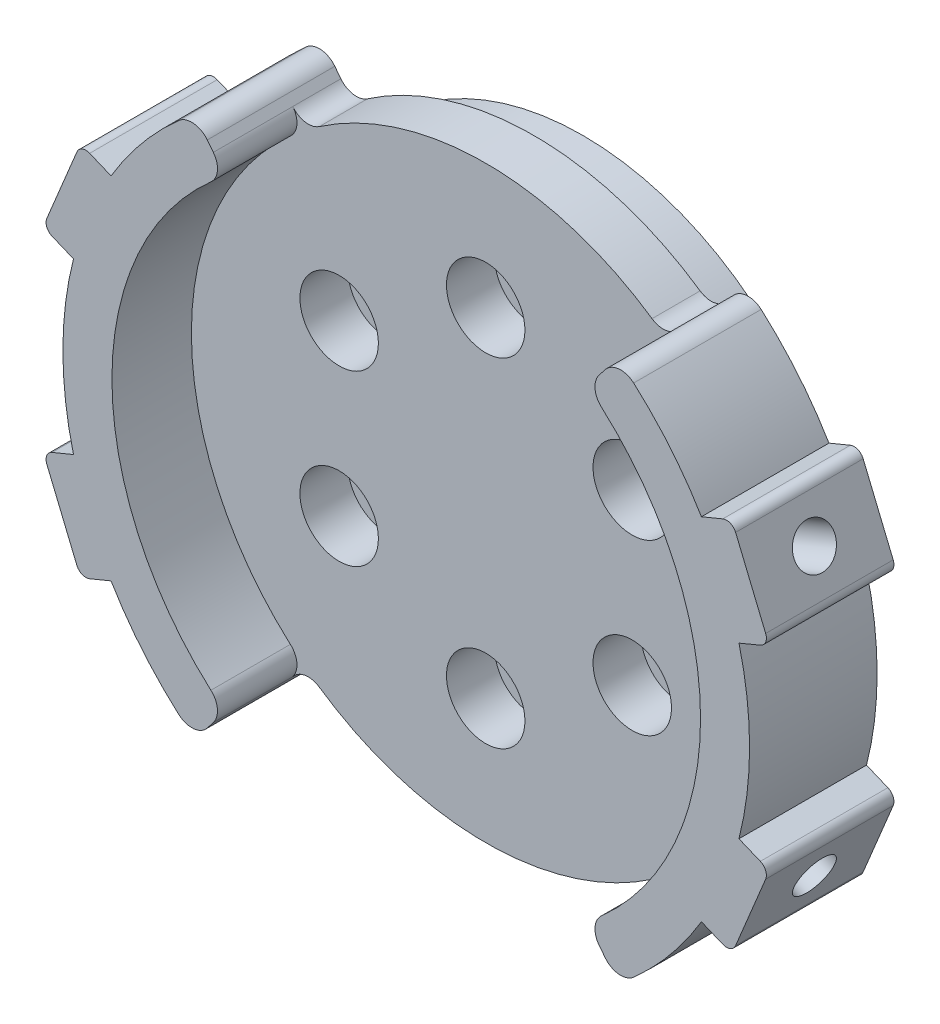
from build123d import *
from build123d.topology import SkipClean

# Parameters (mm, degrees)
SKETCH_1_R           = 30
SKETCH_1_R_2         = 2.1
EXTRUDE_1_DEPTH      = 5
EXTRUDE_2_DEPTH      = 8
EXTRUDE_2_DEPTH_BACK = 5
EXTRUDE_3_DEPTH      = 13
CUT_EXTRUDE_2_DEPTH  = 7.5
CUT_EXTRUDE_3_DEPTH  = 7.5
CUT_EXTRUDE_START    = -7.5
CUT_EXTRUDE_4_DEPTH  = 7.5
CUT_EXTRUDE_5_DEPTH  = 7.5
FILLET_1_R           = 2
FILLET_2_R           = 2
EXTRUDE_START        = 5
SKETCH_8_R           = 27.5
SKETCH_8_R_2         = 2.1
EXTRUDE_4_DEPTH      = 5
CUT_EXTRUDE_START_2  = -5
SKETCH_9_R           = 4
SKETCH_9_R_2         = 2.1
CUT_EXTRUDE_6_DEPTH  = 5
FILLET_3_R           = 1
CUT_EXTRUDE_START_3  = -0.1
CUT_EXTRUDE_7_DEPTH  = 0.1


with BuildPart() as part:
    # 草图1 → 凸台-拉伸1 (new body)
    with BuildSketch(Plane.XY):
        Circle(SKETCH_1_R)
        with Locations((0, 17.25)):
            Circle(SKETCH_1_R_2, mode=Mode.SUBTRACT)
        with Locations((14.938938215, 8.625)):
            Circle(SKETCH_1_R_2, mode=Mode.SUBTRACT)
        with Locations((14.938938215, -8.625)):
            Circle(SKETCH_1_R_2, mode=Mode.SUBTRACT)
        with Locations((0, -17.25)):
            Circle(SKETCH_1_R_2, mode=Mode.SUBTRACT)
        with Locations((-14.938938215, -8.625)):
            Circle(SKETCH_1_R_2, mode=Mode.SUBTRACT)
        with Locations((-14.938938215, 8.625)):
            Circle(SKETCH_1_R_2, mode=Mode.SUBTRACT)
    extrude(amount=EXTRUDE_1_DEPTH)

    # 草图2 → 凸台-拉伸2 (add, two sides: drawn at the far end of the back side and taken through both)
    with BuildSketch(Plane.XY.offset(5).offset(-EXTRUDE_2_DEPTH_BACK)):
        with BuildLine():
            ThreePointArc((-18.46984426, -23.640322608), (-26.963821389, -13.151134404), (-30, 0))
            Line((-30, 0), (-35, 0))
            ThreePointArc((-35, 0), (-31.45779162, -15.342990138), (-21.548151636, -27.580376376))
            Line((-21.548151636, -27.580376376), (-18.46984426, -23.640322608))
        make_face()
        with BuildLine():
            Line((-35, 0), (-30, 0))
            ThreePointArc((-30, 0), (-26.963821389, 13.151134404), (-18.46984426, 23.640322608))
            Line((-18.46984426, 23.640322608), (-21.548151636, 27.580376376))
            ThreePointArc((-21.548151636, 27.580376376), (-31.45779162, 15.342990138), (-35, 0))
        make_face()
        with BuildLine():
            ThreePointArc((30, 0), (26.963821389, -13.151134404), (18.46984426, -23.640322608))
            Line((18.46984426, -23.640322608), (21.548151636, -27.580376376))
            ThreePointArc((21.548151636, -27.580376376), (31.45779162, -15.342990138), (35, 0))
            ThreePointArc((35, 0), (31.45779162, 15.342990138), (21.548151636, 27.580376376))
            Line((21.548151636, 27.580376376), (18.46984426, 23.640322608))
            ThreePointArc((18.46984426, 23.640322608), (26.963821389, 13.151134404), (30, 0))
        make_face()
    extrude(amount=EXTRUDE_2_DEPTH + EXTRUDE_2_DEPTH_BACK)

    # 草图3 → 凸台-拉伸3 (add, through all)
    with BuildSketch(Plane.XY.offset(13)):
        with BuildLine():
            Line((33.194005074, 19.161368092), (30.090708646, 17.875940624))
            ThreePointArc((30.090708646, 17.875940624), (32.335783638, 13.393920133), (33.917542969, 8.637145299))
            Line((33.917542969, 8.637145299), (37.020839397, 9.922572767))
            Line((37.020839397, 9.922572767), (33.194005074, 19.161368092))
        make_face()
        with BuildLine():
            ThreePointArc((33.917542969, -8.637145299), (32.335783638, -13.393920133), (30.090708646, -17.875940624))
            Line((30.090708646, -17.875940624), (33.194005074, -19.161368092))
            Line((33.194005074, -19.161368092), (37.020839397, -9.922572767))
            Line((37.020839397, -9.922572767), (33.917542969, -8.637145299))
        make_face()
        with BuildLine():
            ThreePointArc((-30.090708646, -17.875940624), (-32.335783638, -13.393920133), (-33.917542969, -8.637145299))
            Line((-33.917542969, -8.637145299), (-37.020839397, -9.922572767))
            Line((-37.020839397, -9.922572767), (-33.194005074, -19.161368092))
            Line((-33.194005074, -19.161368092), (-30.090708646, -17.875940624))
        make_face()
        with BuildLine():
            Line((-35.107422235, 14.54197043), (-32.335783638, 13.393920133))
            ThreePointArc((-32.335783638, 13.393920133), (-31.293591383, 15.675175864), (-30.090708646, 17.875940624))
            Line((-30.090708646, 17.875940624), (-33.194005074, 19.161368092))
            Line((-33.194005074, 19.161368092), (-35.107422235, 14.54197043))
        make_face()
        with BuildLine():
            ThreePointArc((-33.917542969, 8.637145299), (-33.211933824, 11.043887525), (-32.335783638, 13.393920133))
            Line((-32.335783638, 13.393920133), (-35.107422235, 14.54197043))
            Line((-35.107422235, 14.54197043), (-37.020839397, 9.922572767))
            Line((-37.020839397, 9.922572767), (-33.917542969, 8.637145299))
        make_face()
    extrude(amount=-EXTRUDE_3_DEPTH)

    # 草图4 → 切除-拉伸2 (cut)
    with BuildSketch(Plane(origin=(-35.107422235, 14.54197043, 0), x_dir=(0, 0, 1), z_dir=(-0.9238795325112878, 0.38268343236508695, 0))):
        with BuildLine():
            ThreePointArc((6.5, -2.1), (7.98492424, -1.48492424), (8.6, 0))
            Line((8.6, 0), (6.5, 0))
            Line((6.5, 0), (6.5, -2.1))
        make_face()
        with BuildLine():
            Line((6.5, 0), (8.6, 0))
            ThreePointArc((8.6, 0), (7.98492424, 1.48492424), (6.5, 2.1))
            Line((6.5, 2.1), (6.5, 0))
        make_face()
        with BuildLine():
            Line((6.5, -2.1), (6.5, 0))
            Line((6.5, 0), (4.4, 0))
            ThreePointArc((4.4, 0), (5.01507576, -1.48492424), (6.5, -2.1))
        make_face()
        with BuildLine():
            Line((4.4, 0), (6.5, 0))
            Line((6.5, 0), (6.5, 2.1))
            ThreePointArc((6.5, 2.1), (5.01507576, 1.48492424), (4.4, 0))
        make_face()
    extrude(amount=-CUT_EXTRUDE_2_DEPTH, mode=Mode.SUBTRACT)

    # 草图5 → 切除-拉伸3 (cut)
    with BuildSketch(Plane(origin=(-35.107422235, -14.54197043, 0), x_dir=(0, 0, 1), z_dir=(-0.9238795325112881, -0.3826834323650867, 0))):
        with BuildLine():
            ThreePointArc((6.5, 2.1), (5.01507576, 1.48492424), (4.4, 0))
            Line((4.4, 0), (6.5, 0))
            Line((6.5, 0), (6.5, 2.1))
        make_face()
        with BuildLine():
            Line((6.5, 0), (4.4, 0))
            ThreePointArc((4.4, 0), (5.01507576, -1.48492424), (6.5, -2.1))
            Line((6.5, -2.1), (6.5, 0))
        make_face()
        with BuildLine():
            Line((6.5, 2.1), (6.5, 0))
            Line((6.5, 0), (8.6, 0))
            ThreePointArc((8.6, 0), (7.98492424, 1.48492424), (6.5, 2.1))
        make_face()
        with BuildLine():
            Line((8.6, 0), (6.5, 0))
            Line((6.5, 0), (6.5, -2.1))
            ThreePointArc((6.5, -2.1), (7.98492424, -1.48492424), (8.6, 0))
        make_face()
    extrude(amount=-CUT_EXTRUDE_3_DEPTH, mode=Mode.SUBTRACT)

    # 草图6 → 切除-拉伸4 (cut)
    with BuildSketch(Plane(origin=(35.107422235, 14.54197043, 0), x_dir=(0, 0, -1), z_dir=(0.9238795325112878, 0.38268343236508695, 0)).offset(CUT_EXTRUDE_START)):
        with BuildLine():
            ThreePointArc((-8.6, 0), (-6.5, -2.1), (-4.4, 0))
            Line((-4.4, 0), (-8.6, 0))
        make_face()
        with BuildLine():
            Line((-8.6, 0), (-4.4, 0))
            ThreePointArc((-4.4, 0), (-6.5, 2.1), (-8.6, 0))
        make_face()
    extrude(amount=CUT_EXTRUDE_4_DEPTH, mode=Mode.SUBTRACT)

    # 草图7 → 切除-拉伸5 (cut)
    with BuildSketch(Plane(origin=(35.107422235, -14.54197043, 0), x_dir=(0, 0, -1), z_dir=(0.9238795325112881, -0.3826834323650867, 0)).offset(CUT_EXTRUDE_START)):
        with BuildLine():
            ThreePointArc((-8.6, 0), (-6.5, -2.1), (-4.4, 0))
            Line((-4.4, 0), (-8.6, 0))
        make_face()
        with BuildLine():
            Line((-8.6, 0), (-4.4, 0))
            ThreePointArc((-4.4, 0), (-6.5, 2.1), (-8.6, 0))
        make_face()
    extrude(amount=CUT_EXTRUDE_5_DEPTH, mode=Mode.SUBTRACT)

    # 圆角1
    fillet_1_edges = [part.edges().sort_by_distance(p)[0] for p in [
        (-18.46984426, 23.640322608, 9),
        (-18.46984426, -23.640322608, 9),
        (-21.548151636, -27.580376376, 6.5),
        (-21.548151636, 27.580376376, 6.5),
        (18.46984426, -23.640322608, 9),
        (21.548151636, -27.580376376, 6.5),
        (21.548151636, 27.580376376, 6.5),
        (18.46984426, 23.640322608, 9),
    ]]
    fillet(fillet_1_edges, radius=FILLET_1_R)

    # 圆角2
    fillet_2_edges = [part.edges().sort_by_distance(p)[0] for p in [
        (-18.46984426, 23.640322608, 2.5),
        (18.46984426, 23.640322608, 2.5),
        (18.46984426, -23.640322608, 2.5),
        (-18.46984426, -23.640322608, 2.5),
    ]]
    fillet(fillet_2_edges, radius=FILLET_2_R)

    # 草图8 → 凸台-拉伸4 (add)
    with SkipClean():  # the faces are left unmerged after this step: merging them gives an invalid solid
        with BuildSketch(Plane(origin=(0, 0, 0), x_dir=(-1, 0, 0), z_dir=(0, 0, -1)).offset(EXTRUDE_START)):
            with Locations(Location((0, 0, 0), (0, 0, 180))):
                Circle(SKETCH_8_R)
            with Locations((0, 17.25)):
                Circle(SKETCH_8_R_2, mode=Mode.SUBTRACT)
            with Locations((-14.938938215, 8.625)):
                Circle(SKETCH_8_R_2, mode=Mode.SUBTRACT)
            with Locations((-14.938938215, -8.625)):
                Circle(SKETCH_8_R_2, mode=Mode.SUBTRACT)
            with Locations((0, -17.25)):
                Circle(SKETCH_8_R_2, mode=Mode.SUBTRACT)
            with Locations((14.938938215, -8.625)):
                Circle(SKETCH_8_R_2, mode=Mode.SUBTRACT)
            with Locations((14.938938215, 8.625)):
                Circle(SKETCH_8_R_2, mode=Mode.SUBTRACT)
        extrude(amount=-EXTRUDE_4_DEPTH)

    # 草图9 → 切除-拉伸6 (cut)
    # profile 1 of 6: a face of its own
    with BuildSketch(Plane.XY.offset(5).offset(CUT_EXTRUDE_START_2)):
        with Locations((-14.938938215, 8.625)):
            Circle(SKETCH_9_R)
        with Locations(Location((-14.938938215, 8.625, 0), (0, 0, 180))):
            Circle(SKETCH_9_R_2, mode=Mode.SUBTRACT)
    # profile 2 of 6: a face of its own
    with BuildSketch(Plane.XY.offset(5).offset(CUT_EXTRUDE_START_2)):
        with Locations((-14.938938215, -8.625)):
            Circle(SKETCH_9_R)
        with Locations(Location((-14.938938215, -8.625, 0), (0, 0, 180))):
            Circle(SKETCH_9_R_2, mode=Mode.SUBTRACT)
    # profile 3 of 6: a face of its own
    with BuildSketch(Plane.XY.offset(5).offset(CUT_EXTRUDE_START_2)):
        with Locations((0, 17.25)):
            Circle(SKETCH_9_R)
        with Locations(Location((0, 17.25, 0), (0, 0, 180))):
            Circle(SKETCH_9_R_2, mode=Mode.SUBTRACT)
    # profile 4 of 6: a face of its own
    with BuildSketch(Plane.XY.offset(5).offset(CUT_EXTRUDE_START_2)):
        with Locations((0, -17.25)):
            Circle(SKETCH_9_R)
        with Locations(Location((0, -17.25, 0), (0, 0, 180))):
            Circle(SKETCH_9_R_2, mode=Mode.SUBTRACT)
    # profile 5 of 6: a face of its own
    with BuildSketch(Plane.XY.offset(5).offset(CUT_EXTRUDE_START_2)):
        with Locations((14.938938215, -8.625)):
            Circle(SKETCH_9_R)
        with Locations(Location((14.938938215, -8.625, 0), (0, 0, 180))):
            Circle(SKETCH_9_R_2, mode=Mode.SUBTRACT)
    # profile 6 of 6: a face of its own
    with BuildSketch(Plane.XY.offset(5).offset(CUT_EXTRUDE_START_2)):
        with Locations((14.938938215, 8.625)):
            Circle(SKETCH_9_R)
        with Locations(Location((14.938938215, 8.625, 0), (0, 0, 180))):
            Circle(SKETCH_9_R_2, mode=Mode.SUBTRACT)
    extrude(amount=CUT_EXTRUDE_6_DEPTH, mode=Mode.SUBTRACT)

    # 圆角3
    fillet_3_edges = [part.edges().sort_by_distance(p)[0] for p in [
        (33.194005074, 19.161368092, 6.5),
        (37.020839397, 9.922572767, 6.5),
        (37.020839397, -9.922572767, 6.5),
        (33.194005074, -19.161368092, 6.5),
        (-33.194005074, -19.161368092, 6.5),
        (-37.020839397, -9.922572767, 6.5),
        (-37.020839397, 9.922572767, 6.5),
        (-33.194005074, 19.161368092, 6.5),
    ]]
    fillet(fillet_3_edges, radius=FILLET_3_R)

    # 草图10 → 切除-拉伸7 (cut)
    with BuildSketch(Plane.XY.offset(5).offset(CUT_EXTRUDE_START_3)):
        with BuildLine():
            ThreePointArc((19.662650718, 25.167045253), (19.246929831, 23.75416725), (19.911255211, 22.439739658))
            ThreePointArc((19.911255211, 22.439739658), (30, 0), (19.911255211, -22.439739658))
            ThreePointArc((19.911255211, -22.439739658), (19.246929831, -23.75416725), (19.662650718, -25.167045253))
            ThreePointArc((19.662650718, -25.167045253), (18.392313215, -24.421866929), (16.956214885, -24.748470191))
            ThreePointArc((16.956214885, -24.748470191), (0, -30), (-16.956214885, -24.748470191))
            ThreePointArc((-16.956214885, -24.748470191), (-18.392313215, -24.421866929), (-19.662650718, -25.167045253))
            ThreePointArc((-19.662650718, -25.167045253), (-19.246929831, -23.75416725), (-19.911255211, -22.439739658))
            ThreePointArc((-19.911255211, -22.439739658), (-30, 0), (-19.911255211, 22.439739658))
            ThreePointArc((-19.911255211, 22.439739658), (-19.246929831, 23.75416725), (-19.662650718, 25.167045253))
            ThreePointArc((-19.662650718, 25.167045253), (-18.392313215, 24.421866929), (-16.956214885, 24.748470191))
            ThreePointArc((-16.956214885, 24.748470191), (0, 30), (16.956214885, 24.748470191))
            ThreePointArc((16.956214885, 24.748470191), (18.392313215, 24.421866929), (19.662650718, 25.167045253))
        make_face()
    extrude(amount=CUT_EXTRUDE_7_DEPTH, mode=Mode.SUBTRACT)


solid = part.part
